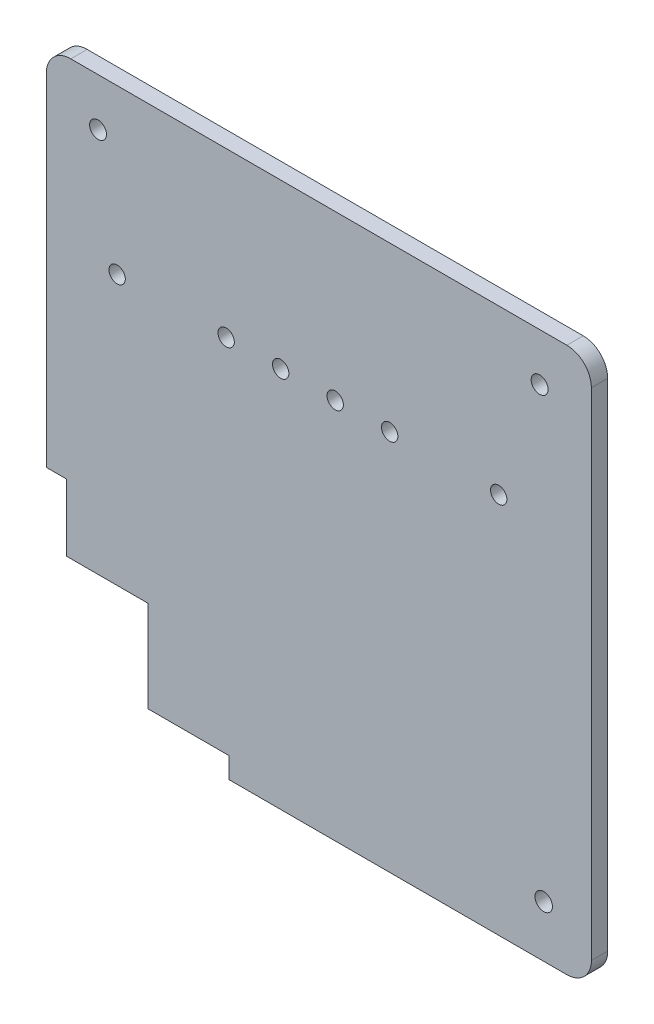
from build123d import *

# Parameters (mm, degrees)
SKETCH1_W           = 127.279746886
SKETCH1_H           = 103.580209895
BOSS_EXTRUDE1_DEPTH = 3
SKETCH4_W           = 136.608236075
SKETCH4_H           = 109.831739099
CUT_EXTRUDE2_DEPTH  = 10
SKETCH5_R           = 1.55
SKETCH5_R_2         = 1.6
CUT_EXTRUDE3_DEPTH  = 10
SKETCH6_R           = 1.5
CUT_EXTRUDE4_DEPTH  = 10


with BuildPart() as part:
    # Sketch1 → Boss-Extrude1 (new body)
    with BuildSketch(Plane.XY):
        with Locations((63.639873443, 51.790104948)):
            Rectangle(SKETCH1_W, SKETCH1_H)
    extrude(amount=BOSS_EXTRUDE1_DEPTH)

    # Sketch4 → Cut-Extrude2 (cut)
    with BuildSketch(Plane.XY.offset(3)):
        with Locations((62.542352249, 51.998881619)):
            Rectangle(SKETCH4_W, SKETCH4_H)
        with BuildLine():
            Line((16.784625535, 34.613434216), (16.784625535, 97.261353998))
            add(Edge.make_bspline(
                [(16.784625535, 97.261353998), (16.814535165, 99.668332355), (18.795239635, 101.818752837), (21.284625535, 101.761353998)],
                knots=[0, 0, 0, 0, 1, 1, 1, 1], degree=3))
            Line((21.284625535, 101.761353998), (112.284625535, 101.761353998))
            add(Edge.make_bspline(
                [(112.284625535, 101.761353998), (114.750732895, 101.731954246), (116.737279379, 99.843042628), (116.784625535, 97.261353998)],
                knots=[0, 0, 0, 0, 1, 1, 1, 1], degree=3))
            Line((116.784625535, 97.261353998), (116.784625535, 6.261353998))
            add(Edge.make_bspline(
                [(116.784625535, 6.261353998), (116.776314504, 3.746141668), (114.734063303, 1.774849688), (112.284625535, 1.761353998)],
                knots=[0, 0, 0, 0, 1, 1, 1, 1], degree=3))
            Line((112.284625535, 1.761353998), (50.304591007, 1.761353998))
            Line((50.304591007, 1.761353998), (50.304591007, 5.583127479))
            Line((50.304591007, 5.583127479), (35.442949081, 5.583127479))
            Line((35.442949081, 5.583127479), (35.442949081, 22.35270073))
            Line((35.442949081, 22.35270073), (20.490844042, 22.35270073))
            Line((20.490844042, 22.35270073), (20.490844042, 34.613434216))
            Line((20.490844042, 34.613434216), (16.784625535, 34.613434216))
        make_face(mode=Mode.SUBTRACT)
    extrude(amount=-CUT_EXTRUDE2_DEPTH, mode=Mode.SUBTRACT)

    # Sketch5 → Cut-Extrude3 (cut)
    with BuildSketch(Plane.XY.offset(3)):
        with Locations((26.284625535, 93.011353998)):
            Circle(SKETCH5_R)
        with Locations((107.284625535, 93.011353998)):
            Circle(SKETCH5_R)
        with Locations((108.034625535, 11.261353998)):
            Circle(SKETCH5_R_2)
    extrude(amount=-CUT_EXTRUDE3_DEPTH, mode=Mode.SUBTRACT)

    # Sketch6 → Cut-Extrude4 (cut)
    with BuildSketch(Plane.XY.offset(3)):
        with Locations((29.784625535, 71.761353998)):
            Circle(SKETCH6_R)
        with Locations((49.784625535, 71.761353998)):
            Circle(SKETCH6_R)
        with Locations((59.784625535, 71.761353998)):
            Circle(SKETCH6_R)
        with Locations((69.784625535, 71.761353998)):
            Circle(SKETCH6_R)
        with Locations((79.784625535, 71.761353998)):
            Circle(SKETCH6_R)
        with Locations((99.784625535, 71.761353998)):
            Circle(SKETCH6_R)
    extrude(amount=-CUT_EXTRUDE4_DEPTH, mode=Mode.SUBTRACT)


solid = part.part
